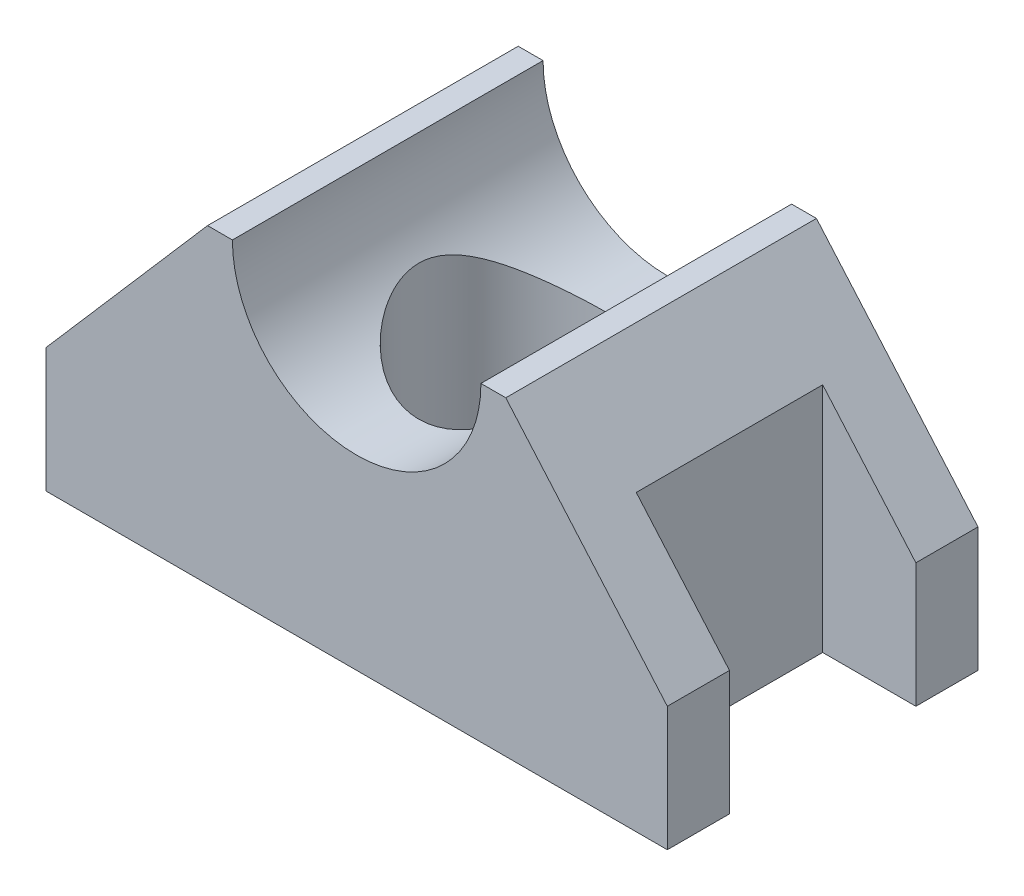
from build123d import *

# Parameters (mm, degrees)
BOSS_EXTRUDE1_DEPTH = 50
SKETCH2_R           = 15
CUT_EXTRUDE1_DEPTH  = 50
CUT_EXTRUDE2_DEPTH  = 30


with BuildPart() as part:
    # Sketch1 → Boss-Extrude1 (new body)
    with BuildSketch(Plane.XY):
        with BuildLine():
            Line((-68.152842986, 0), (-68.152842986, 20))
            Line((-68.152842986, 20), (-42.152842986, 50))
            Line((-42.152842986, 50), (-38.152842986, 50))
            ThreePointArc((-38.152842986, 50), (-18.152842986, 30), (1.847157014, 50))
            Line((1.847157014, 50), (5.847157014, 50))
            Line((5.847157014, 50), (31.847157014, 20))
            Line((31.847157014, 20), (31.847157014, 0))
            Line((31.847157014, 0), (-68.152842986, 0))
        make_face()
    extrude(amount=-BOSS_EXTRUDE1_DEPTH)

    # Sketch2 → Cut-Extrude1 (cut)
    with BuildSketch(Plane(origin=(0, 50, 0), x_dir=(1, 0, 0), z_dir=(0, 1, 0))):
        with Locations(Location((-18.152842986, 25, 0), (0, 0, 180))):
            Circle(SKETCH2_R)
    extrude(amount=-CUT_EXTRUDE1_DEPTH, mode=Mode.SUBTRACT)

    # Sketch3 → Cut-Extrude2 (cut)
    with BuildSketch(Plane.XY.offset(-10)):
        Polygon((31.847157014, 0), (31.847157014, 20), (16.847157014, 37.307692308), (16.847157014, 0), align=None)
        Polygon((-68.152842986, 0), (-68.152842986, 20), (-53.152842986, 37.307692308), (-53.152842986, 0), align=None)
    extrude(amount=-CUT_EXTRUDE2_DEPTH, mode=Mode.SUBTRACT)


solid = part.part
